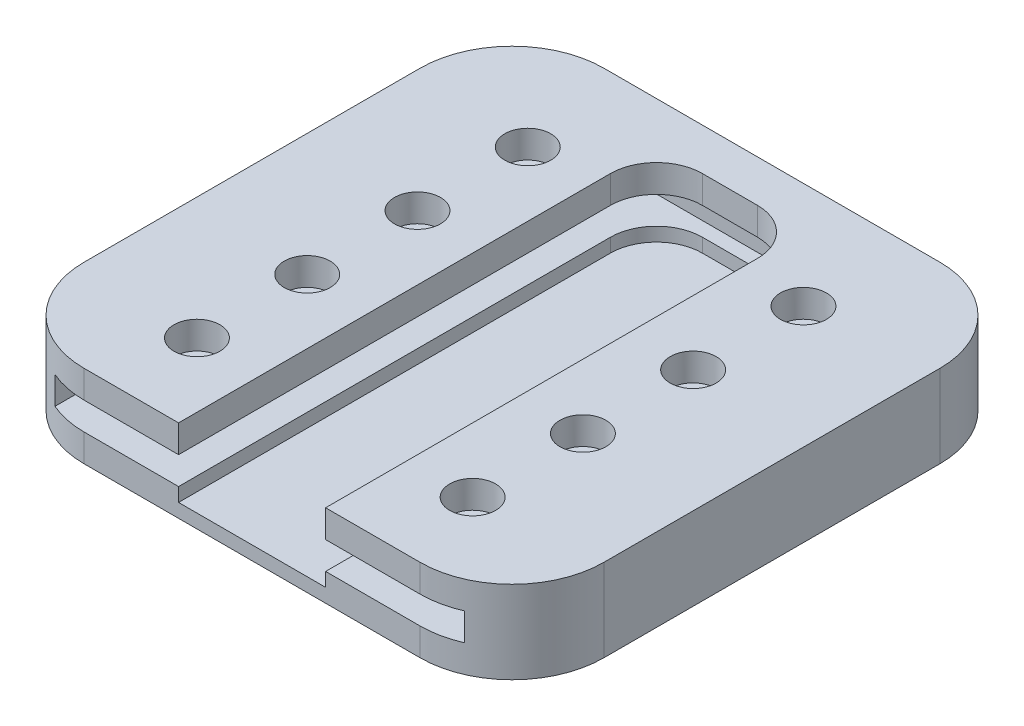
from build123d import *

# Parameters (mm, degrees)
EXTRUDE_1_DEPTH     = 3
SKETCH_3_R          = 3.18
EXTRUDE_2_DEPTH     = 8
EXTRUDE_3_DEPTH     = 3
EXTRUDE_4_DEPTH     = 3
SKETCH_7_R          = 2.5
CUT_EXTRUDE_1_DEPTH = 7.5


with BuildPart() as part:
    # 草图2 → 凸台-拉伸1 (new body)
    with BuildSketch(Plane(origin=(0, 0, 0), x_dir=(1, 0, 0), z_dir=(0, 1, 0))):
        with BuildLine():
            Line((28.284271247, -18.284271247), (28.284271247, 18.284271247))
            ThreePointArc((28.284271247, 18.284271247), (25.355339059, 25.355339059), (18.284271247, 28.284271247))
            Line((18.284271247, 28.284271247), (-18.284271247, 28.284271247))
            ThreePointArc((-18.284271247, 28.284271247), (-25.355339059, 25.355339059), (-28.284271247, 18.284271247))
            Line((-28.284271247, 18.284271247), (-28.284271247, -18.284271247))
            ThreePointArc((-28.284271247, -18.284271247), (-25.355339059, -25.355339059), (-18.284271247, -28.284271247))
            Line((-18.284271247, -28.284271247), (18.284271247, -28.284271247))
            ThreePointArc((18.284271247, -28.284271247), (25.355339059, -25.355339059), (28.284271247, -18.284271247))
        make_face()
    extrude(amount=EXTRUDE_1_DEPTH)

    # 草图3 → 凸台-拉伸2 (add)
    with BuildSketch(Plane(origin=(0, 3, 0), x_dir=(1, 0, 0), z_dir=(0, 1, 0))):
        with Locations(Location((12.7, 12.7, 0), (0, 0, 270))):
            Circle(SKETCH_3_R)
        with Locations(Location((12.7, -12.7, 0), (0, 0, 270))):
            Circle(SKETCH_3_R)
        with Locations(Location((-12.7, -12.7, 0), (0, 0, 270))):
            Circle(SKETCH_3_R)
        with Locations(Location((-12.7, 12.7, 0), (0, 0, 270))):
            Circle(SKETCH_3_R)
    extrude(amount=-EXTRUDE_2_DEPTH)

    # 草图5 → 凸台-拉伸3 (add)
    with BuildSketch(Plane(origin=(0, 3, 0), x_dir=(1, 0, 0), z_dir=(0, 1, 0))):
        with BuildLine():
            Line((-12.284271247, 25.284271247), (12.284271247, 25.284271247))
            ThreePointArc((12.284271247, 25.284271247), (19.355339059, 22.355339059), (22.284271247, 15.284271247))
            Line((22.284271247, 15.284271247), (22.284271247, -27.449422637))
            ThreePointArc((22.284271247, -27.449422637), (26.650871513, -23.761496823), (28.284271247, -18.284271247))
            Line((28.284271247, -18.284271247), (28.284271247, 18.284271247))
            ThreePointArc((28.284271247, 18.284271247), (25.355339059, 25.355339059), (18.284271247, 28.284271247))
            Line((18.284271247, 28.284271247), (-18.284271247, 28.284271247))
            ThreePointArc((-18.284271247, 28.284271247), (-25.355339059, 25.355339059), (-28.284271247, 18.284271247))
            Line((-28.284271247, 18.284271247), (-28.284271247, -18.284271247))
            ThreePointArc((-28.284271247, -18.284271247), (-26.650871513, -23.761496823), (-22.284271247, -27.449422637))
            Line((-22.284271247, -27.449422637), (-22.284271247, 15.284271247))
            ThreePointArc((-22.284271247, 15.284271247), (-19.355339059, 22.355339059), (-12.284271247, 25.284271247))
        make_face()
    extrude(amount=EXTRUDE_3_DEPTH)

    # 草图6 → 凸台-拉伸4 (add)
    with BuildSketch(Plane(origin=(0, 6, 0), x_dir=(1, 0, 0), z_dir=(0, 1, 0))):
        with BuildLine():
            Line((-28.284271247, 18.284271247), (-28.284271247, -18.284271247))
            ThreePointArc((-28.284271247, -18.284271247), (-26.650871513, -23.761496823), (-22.284271247, -27.449422637))
            ThreePointArc((-22.284271247, -27.449422637), (-20.327367684, -28.073334377), (-18.284271247, -28.284271247))
            Line((-18.284271247, -28.284271247), (18.284271247, -28.284271247))
            ThreePointArc((18.284271247, -28.284271247), (20.327367684, -28.073334377), (22.284271247, -27.449422637))
            ThreePointArc((22.284271247, -27.449422637), (26.650871513, -23.761496823), (28.284271247, -18.284271247))
            Line((28.284271247, -18.284271247), (28.284271247, 18.284271247))
            ThreePointArc((28.284271247, 18.284271247), (25.355339059, 25.355339059), (18.284271247, 28.284271247))
            Line((18.284271247, 28.284271247), (-18.284271247, 28.284271247))
            ThreePointArc((-18.284271247, 28.284271247), (-25.355339059, 25.355339059), (-28.284271247, 18.284271247))
        make_face()
    extrude(amount=EXTRUDE_4_DEPTH)

    # 草图7 → 切除-拉伸1 (cut)
    with BuildSketch(Plane(origin=(0, 9, 0), x_dir=(1, 0, 0), z_dir=(0, 1, 0))):
        with Locations(Location((-15, 16.715728753, 0), (0, 0, 270))):
            Circle(SKETCH_7_R)
        with Locations(Location((-15, 4.715728753, 0), (0, 0, 270))):
            Circle(SKETCH_7_R)
        with Locations(Location((-15, -7.284271247, 0), (0, 0, 270))):
            Circle(SKETCH_7_R)
        with Locations(Location((-15, -19.284271247, 0), (0, 0, 270))):
            Circle(SKETCH_7_R)
        with Locations(Location((15, -19.284271247, 0), (0, 0, 270))):
            Circle(SKETCH_7_R)
        with Locations(Location((15, -7.284271247, 0), (0, 0, 270))):
            Circle(SKETCH_7_R)
        with Locations(Location((15, 4.715728753, 0), (0, 0, 270))):
            Circle(SKETCH_7_R)
        with Locations(Location((15, 16.715728753, 0), (0, 0, 270))):
            Circle(SKETCH_7_R)
        with BuildLine():
            Line((-8, -28.284271247), (8, -28.284271247))
            Line((8, -28.284271247), (8, 18.715728753))
            ThreePointArc((8, 18.715728753), (6.535533906, 22.251262658), (3, 23.715728753))
            Line((3, 23.715728753), (-3, 23.715728753))
            ThreePointArc((-3, 23.715728753), (-6.535533906, 22.251262658), (-8, 18.715728753))
            Line((-8, 18.715728753), (-8, -28.284271247))
        make_face()
    extrude(amount=-CUT_EXTRUDE_1_DEPTH, mode=Mode.SUBTRACT)


solid = part.part
